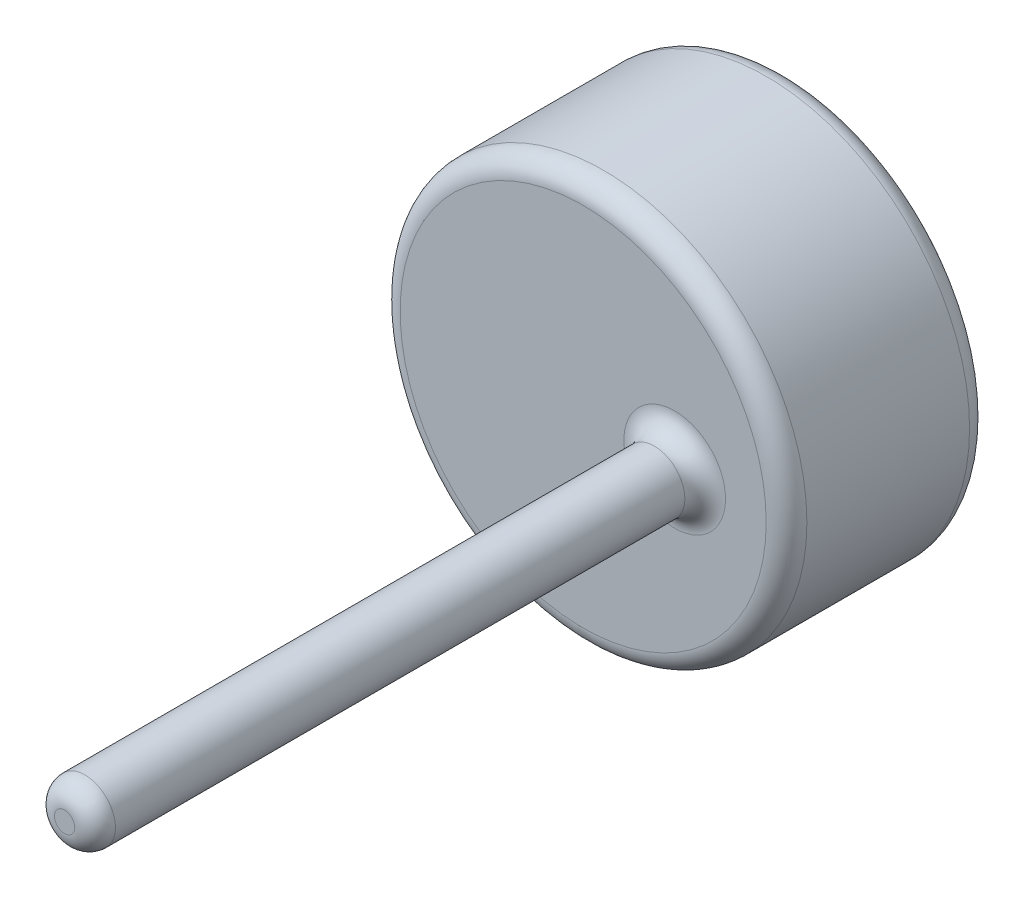
from build123d import *

# Parameters (mm, degrees)
SKETCH1_R           = 10
BOSS_EXTRUDE1_DEPTH = 10
SKETCH2_R           = 1.5
BOSS_EXTRUDE2_DEPTH = 30
FILLET1_R           = 1


with BuildPart() as part:
    # Sketch1 → Boss-Extrude1 (new body)
    with BuildSketch(Plane.XY):
        Circle(SKETCH1_R)
    extrude(amount=BOSS_EXTRUDE1_DEPTH)

    # Sketch2 → Boss-Extrude2 (add)
    with BuildSketch(Plane.XY.offset(10)):
        with Locations((4.5, 0)):
            Circle(SKETCH2_R)
    extrude(amount=BOSS_EXTRUDE2_DEPTH)

    # Fillet1
    fillet1_edges = [part.edges().sort_by_distance(p)[0] for p in [
        (-10, 0, 0),
        (-10, 0, 10),
        (3, 0, 10),
        (3, 0, 40),
    ]]
    fillet(fillet1_edges, radius=FILLET1_R)


solid = part.part
